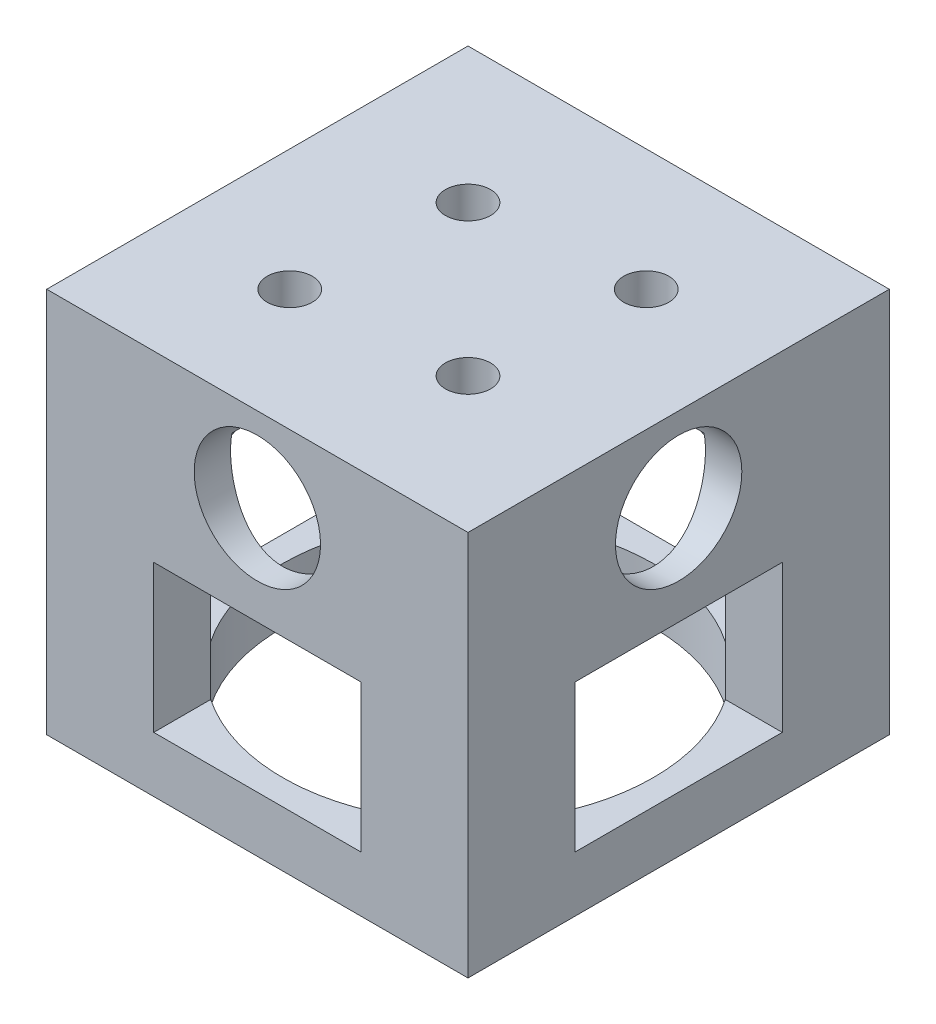
from build123d import *

# Parameters (mm, degrees)
SKETCH1_W                 = 31.75
SKETCH1_H                 = 31.75
BOSS_EXTRUDE1_DEPTH       = 5.08
M3_CLEARANCE_HOLE1_D      = 3.4
M3_CLEARANCE_HOLE1_DEPTH  = 15.24
M3_CLEARANCE_HOLE1_TIP    = 1.021463052
SKETCH7_W                 = 31.75
SKETCH7_H                 = 31.75
SKETCH7_R                 = 13.97
BOSS_EXTRUDE2_DEPTH       = 24
M3X0_5_TAPPED_HOLE1_D     = 2.5
M3X0_5_TAPPED_HOLE1_DEPTH = 15.24
M3X0_5_TAPPED_HOLE1_TIP   = 0.751075774
SKETCH12_R                = 4.7625
CUT_EXTRUDE1_DEPTH        = 6.35
CUT_EXTRUDE2_REACH        = 44.849
CUT_EXTRUDE2_END_RADIUS   = 13.97
SKETCH13_W                = 15.618932536
SKETCH13_H                = 11.098734185
CIRPATTERN1_COUNT         = 4
CIRPATTERN2_COUNT         = 4


with BuildPart() as part:
    # Sketch1 → Boss-Extrude1 (new body)
    with BuildSketch(Plane(origin=(0, 0, 0), x_dir=(1, 0, 0), z_dir=(0, 1, 0))):
        Rectangle(SKETCH1_W, SKETCH1_H)
    extrude(amount=BOSS_EXTRUDE1_DEPTH)

    # M3 Clearance Hole1
    with Locations(Plane(origin=(0, 5.08, 0), x_dir=(1, 0, 0), z_dir=(0, 1, 0))):
        with Locations((-5.656854249, 5.656854249), (6.717514421, 6.717514421), (5.656854249, -5.656854249), (-6.717514421, -6.717514421)):
            Hole(M3_CLEARANCE_HOLE1_D / 2, depth=M3_CLEARANCE_HOLE1_DEPTH)
            with Locations((0, 0, -(M3_CLEARANCE_HOLE1_DEPTH + M3_CLEARANCE_HOLE1_TIP / 2))):  # 118° drill point
                Cone(0, M3_CLEARANCE_HOLE1_D / 2, M3_CLEARANCE_HOLE1_TIP, mode=Mode.SUBTRACT)

    # Sketch7 → Boss-Extrude2 (add)
    with BuildSketch(Plane.XZ):
        Rectangle(SKETCH7_W, SKETCH7_H)
        with Locations(Location((0, 0, 0), (0, 0, 270))):
            Circle(SKETCH7_R, mode=Mode.SUBTRACT)
    extrude(amount=BOSS_EXTRUDE2_DEPTH)

    # M3x0.5 Tapped Hole1
    with Locations(Plane(origin=(0, -24, 0), x_dir=(-1, 0, 0), z_dir=(0, -1, 0))):
        with Locations((-12.7, 12.7), (12.7, 12.7), (12.7, -12.7), (-12.7, -12.7)):
            Hole(M3X0_5_TAPPED_HOLE1_D / 2, depth=M3X0_5_TAPPED_HOLE1_DEPTH)
            with Locations((0, 0, -(M3X0_5_TAPPED_HOLE1_DEPTH + M3X0_5_TAPPED_HOLE1_TIP / 2))):  # 118° drill point
                Cone(0, M3X0_5_TAPPED_HOLE1_D / 2, M3X0_5_TAPPED_HOLE1_TIP, mode=Mode.SUBTRACT)

    # Sketch12 → Cut-Extrude1 (cut)
    with BuildSketch(Plane(origin=(0, 0, -15.875), x_dir=(-1, 0, 0), z_dir=(0, 0, -1))):
        with Locations((0, -1.27)):
            Circle(SKETCH12_R)
    cut_extrude1 = extrude(amount=-CUT_EXTRUDE1_DEPTH, mode=Mode.SUBTRACT)

    # Cut-Extrude2: up to this cylinder (the profile starts outside it)
    cut_extrude2_end = Plane(origin=(0, -14.261548, 0), z_dir=(0, 1, 0)) * Cylinder(CUT_EXTRUDE2_END_RADIUS, 118.638, mode=Mode.PRIVATE)
    # Sketch13 → Cut-Extrude2 (cut, up to the surface)
    with BuildSketch(Plane(origin=(0, 0, -15.875), x_dir=(-1, 0, 0), z_dir=(0, 0, -1)), mode=Mode.PRIVATE) as cut_extrude2_sk1:
        with Locations((0, -14.261548471)):
            Rectangle(SKETCH13_W, SKETCH13_H)
    cut_extrude2_tool1 = extrude(cut_extrude2_sk1.sketch, amount=-CUT_EXTRUDE2_REACH, mode=Mode.PRIVATE) - cut_extrude2_end
    cut_extrude2 = cut_extrude2_tool1.solids().sort_by_distance((0, -14.261548, -15.875))[0]
    add(cut_extrude2, mode=Mode.SUBTRACT)

    # CirPattern1: Cut-Extrude2 ×4 about axis
    cirpattern1_axis = Axis((0, 0, 0), (0, 1, 0))
    for i in range(1, CIRPATTERN1_COUNT):
        add(cut_extrude2.rotate(cirpattern1_axis, i * 360 / CIRPATTERN1_COUNT), mode=Mode.SUBTRACT)

    # CirPattern2: Cut-Extrude1 ×4 about axis
    cirpattern2_axis = Axis((0, 0, 0), (0, 1, 0))
    for i in range(1, CIRPATTERN2_COUNT):
        add(cut_extrude1.rotate(cirpattern2_axis, i * 360 / CIRPATTERN2_COUNT), mode=Mode.SUBTRACT)


solid = part.part
